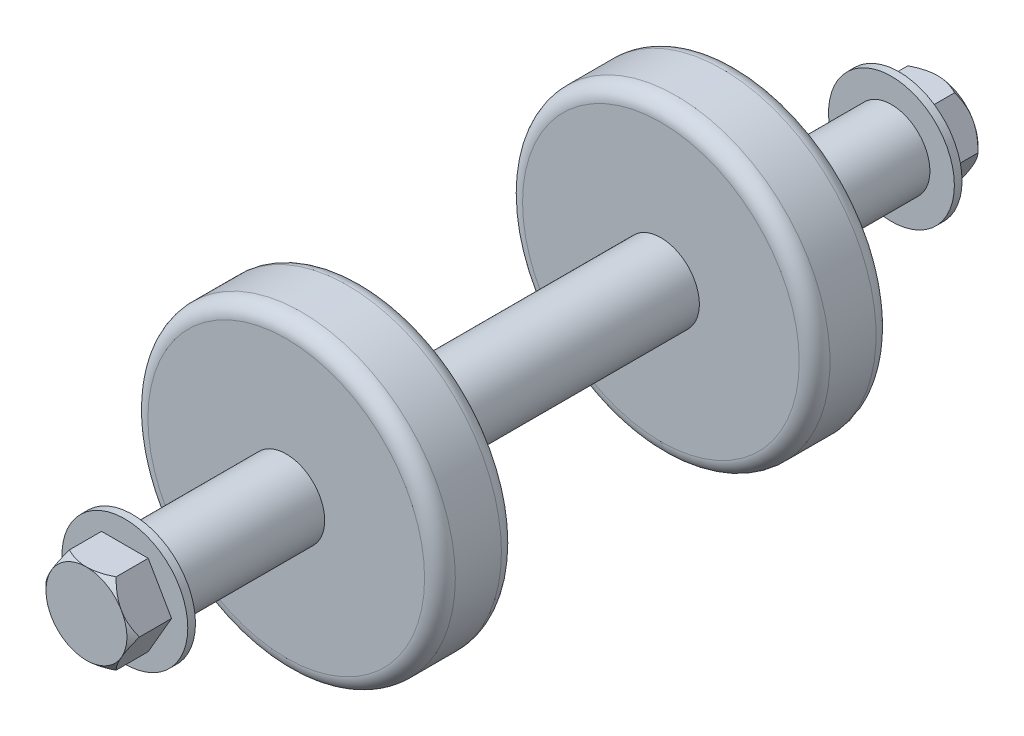
from build123d import *

# Parameters (mm, degrees)
SKETCH1_R           = 25
BOSS_EXTRUDE1_DEPTH = 246.875
SKETCH2_R           = 100
BOSS_EXTRUDE2_DEPTH = 50
FILLET1_R           = 10
SKETCH3_R           = 40.935
BOSS_EXTRUDE3_DEPTH = 5
BOSS_EXTRUDE4_DEPTH = 25
SKETCH5_R           = 34.808926318
SKETCH5_R_2         = 26.31
CUT_EXTRUDE1_DEPTH  = 25
CUT_EXTRUDE1_TAPER  = 45


with BuildPart() as part:
    # Sketch1 → Boss-Extrude1 (new, symmetric)
    with BuildSketch(Plane.XY):
        with Locations(Location((0, 0, 0), (0, 0, 180))):
            Circle(SKETCH1_R)
    extrude(amount=BOSS_EXTRUDE1_DEPTH, both=True)

    # Sketch2 → Boss-Extrude2 (add)
    with BuildSketch(Plane.XY.offset(146.875)):
        Circle(SKETCH2_R)
    boss_extrude2 = extrude(amount=-BOSS_EXTRUDE2_DEPTH)

    # Mirror1: Boss-Extrude2 across plane
    add(boss_extrude2.mirror(Plane.XY))

    # Fillet1
    fillet1_edges = [part.edges().sort_by_distance(p)[0] for p in [
        (-100, 0, -146.875),
        (-100, 0, -96.875),
        (-100, 0, 96.875),
        (-100, 0, 146.875),
    ]]
    fillet(fillet1_edges, radius=FILLET1_R)

    # Sketch3 → Boss-Extrude3 (add)
    with BuildSketch(Plane.XY.offset(246.875)):
        Circle(SKETCH3_R)
    boss_extrude3 = extrude(amount=BOSS_EXTRUDE3_DEPTH)

    # Sketch4 → Boss-Extrude4 (add)
    with BuildSketch(Plane.XY.offset(251.875)):
        Polygon((-30.380171165, 0), (-15.190085582, -26.31), (15.190085582, -26.31), (30.380171165, 0), (15.190085582, 26.31), (-15.190085582, 26.31), align=None)
    boss_extrude4 = extrude(amount=BOSS_EXTRUDE4_DEPTH)

    # Sketch5 → Cut-Extrude1 (cut)
    with BuildSketch(Plane.XY.offset(276.875)):
        Circle(SKETCH5_R)
        Circle(SKETCH5_R_2, mode=Mode.SUBTRACT)
    cut_extrude1 = extrude(amount=-CUT_EXTRUDE1_DEPTH, taper=CUT_EXTRUDE1_TAPER, mode=Mode.SUBTRACT)

    # Mirror2: Boss-Extrude3, Boss-Extrude4, Cut-Extrude1 across plane
    add(boss_extrude3.mirror(Plane.XY))
    add(boss_extrude4.mirror(Plane.XY))
    add(cut_extrude1.mirror(Plane.XY), mode=Mode.SUBTRACT)


solid = part.part
